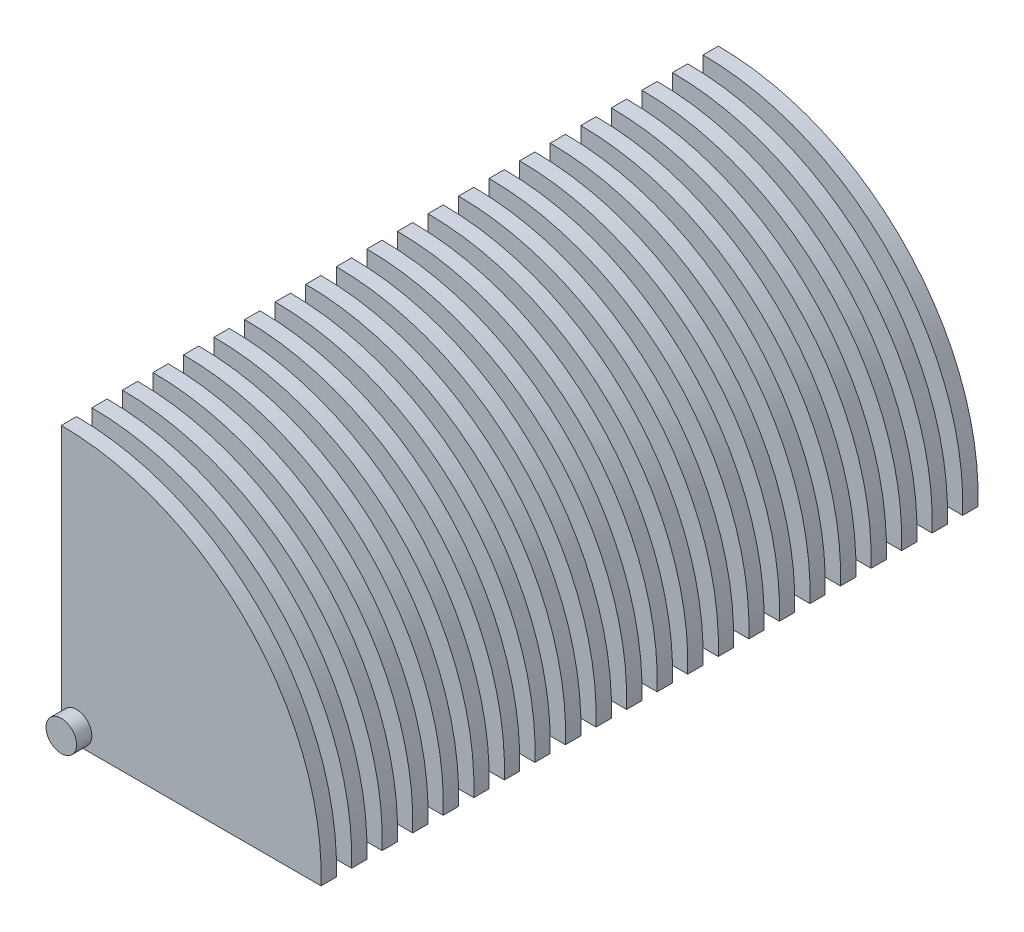
from build123d import *

# Parameters (mm, degrees)
BOSS_EXTRUDE1_DEPTH      = 5
LPATTERN1_COUNT          = 22
LPATTERN1_PITCH          = 10
BOSS_EXTRUDE9_DEPTH      = 10
BOSS_EXTRUDE9_DEPTH_BACK = 220
SKETCH5_R                = 5


with BuildPart() as part:
    # Sketch1 → Boss-Extrude1 (new body)
    with BuildSketch(Plane.XY):
        with BuildLine():
            Line((85, 0), (0, 0))
            Line((0, 0), (0, 88))
            ThreePointArc((0, 88), (61.173932357, 62.037321026), (85, 0))
        make_face()
    extrude(amount=BOSS_EXTRUDE1_DEPTH)


with BuildPart() as lpattern1_1:
    # LPattern1: pattern copy
    add(part.part.moved(Location(Vector(0, 0, -1) * (1 * LPATTERN1_PITCH))))


with BuildPart() as lpattern1_2:
    # LPattern1: pattern copy
    add(part.part.moved(Location(Vector(0, 0, -1) * (2 * LPATTERN1_PITCH))))


with BuildPart() as lpattern1_3:
    # LPattern1: pattern copy
    add(part.part.moved(Location(Vector(0, 0, -1) * (3 * LPATTERN1_PITCH))))


with BuildPart() as lpattern1_4:
    # LPattern1: pattern copy
    add(part.part.moved(Location(Vector(0, 0, -1) * (4 * LPATTERN1_PITCH))))


with BuildPart() as lpattern1_5:
    # LPattern1: pattern copy
    add(part.part.moved(Location(Vector(0, 0, -1) * (5 * LPATTERN1_PITCH))))


with BuildPart() as lpattern1_6:
    # LPattern1: pattern copy
    add(part.part.moved(Location(Vector(0, 0, -1) * (6 * LPATTERN1_PITCH))))


with BuildPart() as lpattern1_7:
    # LPattern1: pattern copy
    add(part.part.moved(Location(Vector(0, 0, -1) * (7 * LPATTERN1_PITCH))))


with BuildPart() as lpattern1_8:
    # LPattern1: pattern copy
    add(part.part.moved(Location(Vector(0, 0, -1) * (8 * LPATTERN1_PITCH))))


with BuildPart() as lpattern1_9:
    # LPattern1: pattern copy
    add(part.part.moved(Location(Vector(0, 0, -1) * (9 * LPATTERN1_PITCH))))


with BuildPart() as lpattern1_10:
    # LPattern1: pattern copy
    add(part.part.moved(Location(Vector(0, 0, -1) * (10 * LPATTERN1_PITCH))))


with BuildPart() as lpattern1_11:
    # LPattern1: pattern copy
    add(part.part.moved(Location(Vector(0, 0, -1) * (11 * LPATTERN1_PITCH))))


with BuildPart() as lpattern1_12:
    # LPattern1: pattern copy
    add(part.part.moved(Location(Vector(0, 0, -1) * (12 * LPATTERN1_PITCH))))


with BuildPart() as lpattern1_13:
    # LPattern1: pattern copy
    add(part.part.moved(Location(Vector(0, 0, -1) * (13 * LPATTERN1_PITCH))))


with BuildPart() as lpattern1_14:
    # LPattern1: pattern copy
    add(part.part.moved(Location(Vector(0, 0, -1) * (14 * LPATTERN1_PITCH))))


with BuildPart() as lpattern1_15:
    # LPattern1: pattern copy
    add(part.part.moved(Location(Vector(0, 0, -1) * (15 * LPATTERN1_PITCH))))


with BuildPart() as lpattern1_16:
    # LPattern1: pattern copy
    add(part.part.moved(Location(Vector(0, 0, -1) * (16 * LPATTERN1_PITCH))))


with BuildPart() as lpattern1_17:
    # LPattern1: pattern copy
    add(part.part.moved(Location(Vector(0, 0, -1) * (17 * LPATTERN1_PITCH))))


with BuildPart() as lpattern1_18:
    # LPattern1: pattern copy
    add(part.part.moved(Location(Vector(0, 0, -1) * (18 * LPATTERN1_PITCH))))


with BuildPart() as lpattern1_19:
    # LPattern1: pattern copy
    add(part.part.moved(Location(Vector(0, 0, -1) * (19 * LPATTERN1_PITCH))))


with BuildPart() as lpattern1_20:
    # LPattern1: pattern copy
    add(part.part.moved(Location(Vector(0, 0, -1) * (20 * LPATTERN1_PITCH))))


with BuildPart() as lpattern1_21:
    # LPattern1: pattern copy
    add(part.part.moved(Location(Vector(0, 0, -1) * (21 * LPATTERN1_PITCH))))


with BuildPart() as body_23:
    # Sketch5 → Boss-Extrude9 (new, two sides: drawn at the far end of the back side and taken through both)
    with BuildSketch(Plane(origin=(0, 0, -210), x_dir=(-1, 0, 0), z_dir=(0, 0, -1)).offset(-BOSS_EXTRUDE9_DEPTH_BACK)):
        with Locations((-5, 5)):
            Circle(SKETCH5_R)
    extrude(amount=BOSS_EXTRUDE9_DEPTH + BOSS_EXTRUDE9_DEPTH_BACK)


solid = Compound([part.part, lpattern1_1.part, lpattern1_2.part, lpattern1_3.part, lpattern1_4.part, lpattern1_5.part, lpattern1_6.part, lpattern1_7.part, lpattern1_8.part, lpattern1_9.part, lpattern1_10.part, lpattern1_11.part, lpattern1_12.part, lpattern1_13.part, lpattern1_14.part, lpattern1_15.part, lpattern1_16.part, lpattern1_17.part, lpattern1_18.part, lpattern1_19.part, lpattern1_20.part, lpattern1_21.part, body_23.part])
